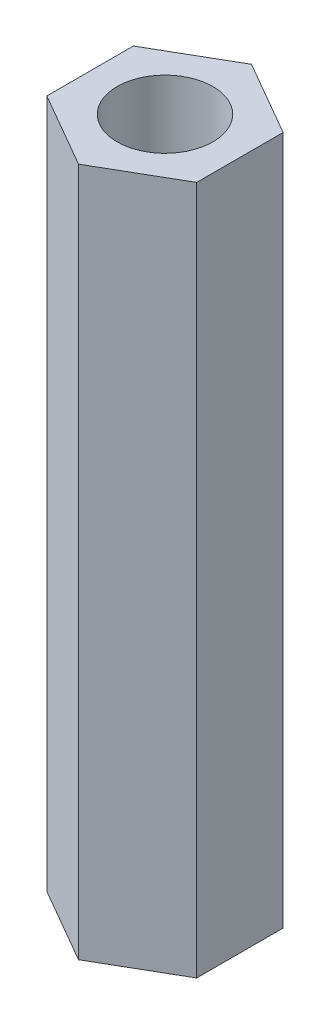
from build123d import *

# Parameters (mm, degrees)
SKETCH_1_R      = 1.6
EXTRUDE_1_DEPTH = 23


with BuildPart() as part:
    # 草图1 → 凸台-拉伸1 (new body)
    with BuildSketch(Plane(origin=(0, 0, 0), x_dir=(1, 0, 0), z_dir=(0, 1, 0))):
        Polygon((0.074146271, 3.924799144), (-2.425853729, 2.481423471), (-2.425853729, -0.405327875), (0.074146271, -1.848703548), (2.574146271, -0.405327875), (2.574146271, 2.481423471), align=None)
        with Locations(Location((0.074146271, 1.038047798, 0), (0, 0, 270))):
            Circle(SKETCH_1_R, mode=Mode.SUBTRACT)
    extrude(amount=EXTRUDE_1_DEPTH)


solid = part.part
